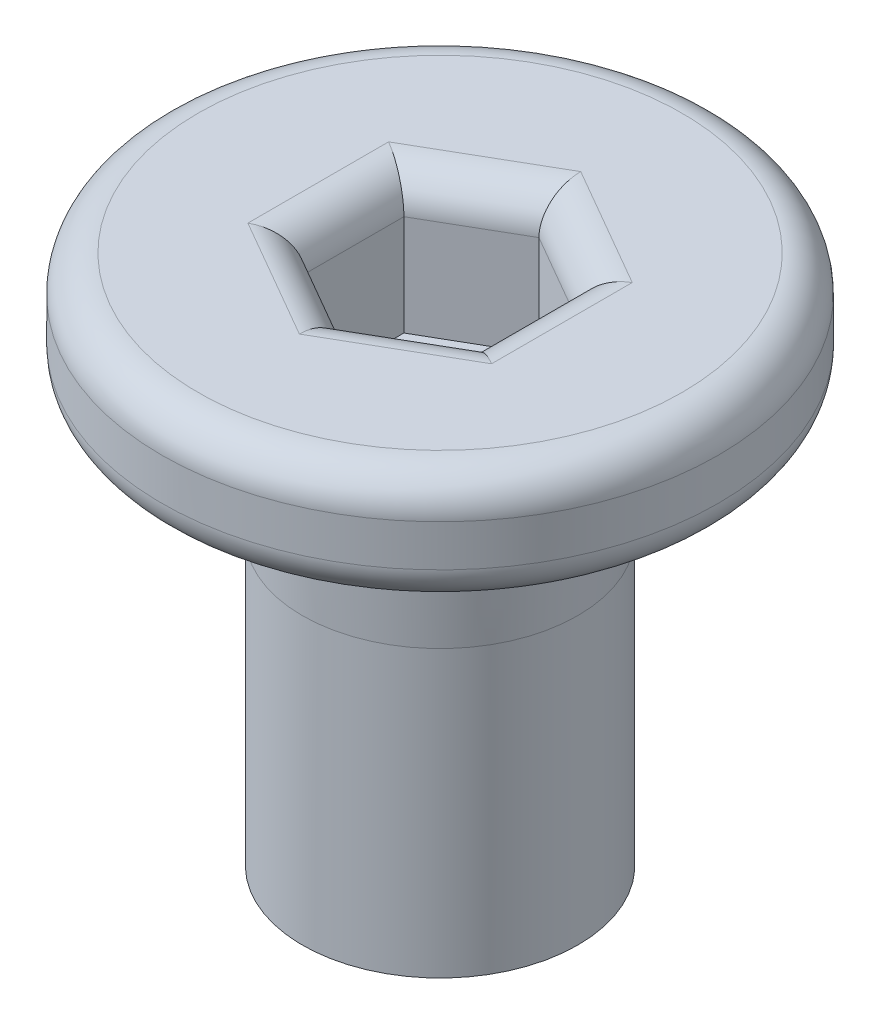
from build123d import *

# Parameters (mm, degrees)
FILLET1_R          = 0.635
CUT_EXTRUDE1_DEPTH = 2.4
FILLET2_R          = 0.635


with BuildPart() as part:
    # Sketch2 → Revolve1 (revolve)
    with BuildSketch(Plane.XY):
        Polygon((0, 4.65), (4.875, 4.65), (4.875, 2.65), (2.5, 2.65), (2.413, 0.35), (2.413, -4.65), (0, -4.65), align=None)
    revolve(axis=Axis((0, -4.65, 0), (0, 1, 0)))

    # Fillet1
    fillet1_edges = [part.edges().sort_by_distance(p)[0] for p in [
        (-2.5, 2.65, 0),
        (-4.875, 2.65, 0),
        (-4.875, 4.65, 0),
    ]]
    fillet(fillet1_edges, radius=FILLET1_R)

    # Sketch3 → Cut-Extrude1 (cut)
    with BuildSketch(Plane(origin=(0, 4.65, 0), x_dir=(1, 0, 0), z_dir=(0, 1, 0))):
        Polygon((0, 1.732050808), (-1.5, 0.866025404), (-1.5, -0.866025404), (0, -1.732050808), (1.5, -0.866025404), (1.5, 0.866025404), align=None)
    extrude(amount=-CUT_EXTRUDE1_DEPTH, mode=Mode.SUBTRACT)

    # Fillet2
    fillet2_edges = [part.edges().sort_by_distance(p)[0] for p in [
        (0.75, 4.65, -1.299038106),
        (-0.75, 4.65, -1.299038106),
        (-1.5, 4.65, 0),
        (-0.75, 4.65, 1.299038106),
        (0.75, 4.65, 1.299038106),
        (1.5, 4.65, 0),
    ]]
    fillet(fillet2_edges, radius=FILLET2_R)


solid = part.part
